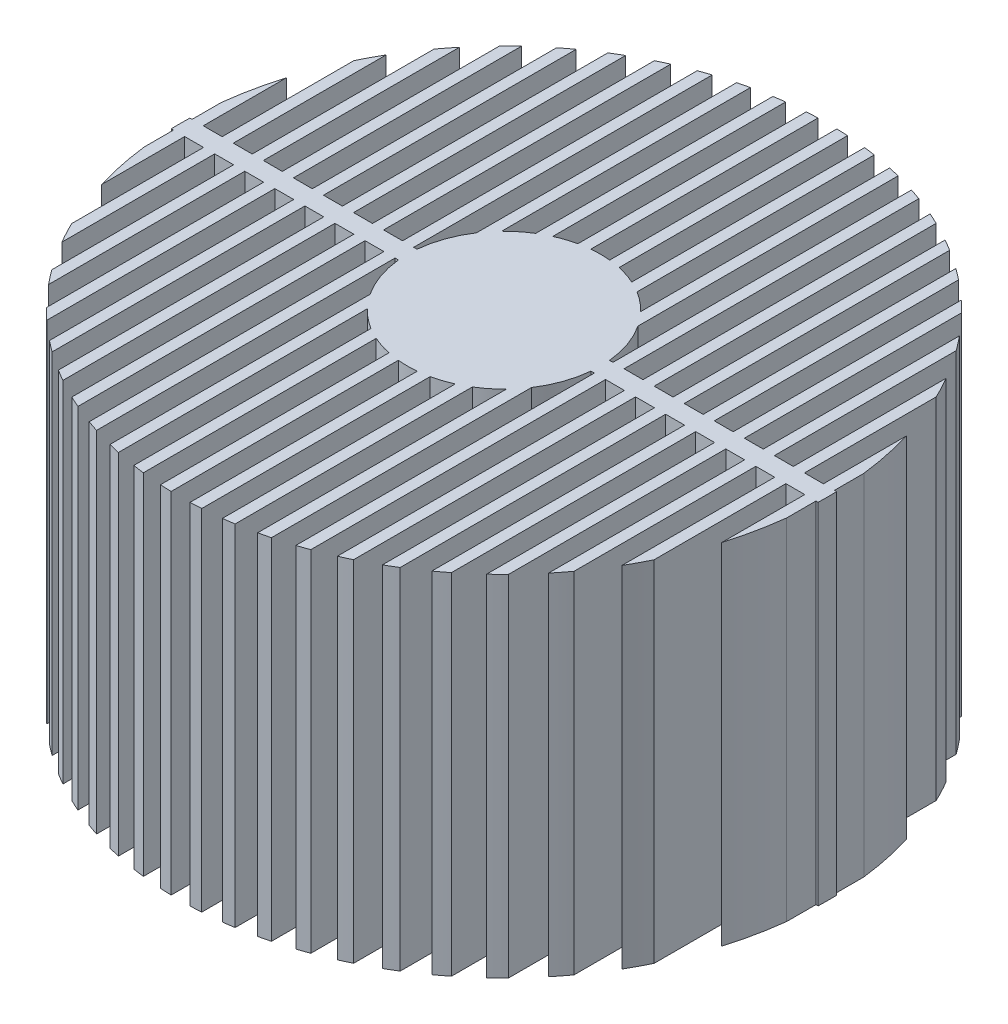
from build123d import *

# Parameters (mm, degrees)
SALIENTE_EXTRUIR3_DEPTH = 47
CROQUIS4_W              = 1.5
CROQUIS4_H              = 87
SALIENTE_EXTRUIR4_DEPTH = 47
CROQUIS5_OUTSIDE_W      = 115.342
CROQUIS5_OUTSIDE_H      = 115.342
CROQUIS5_OUTSIDE_R      = 43.5
CORTAR_EXTRUIR1_DEPTH   = 47


with BuildPart() as part:
    # Croquis3 → Saliente-Extruir3 (new body)
    with BuildSketch(Plane(origin=(0, 0, 0), x_dir=(1, 0, 0), z_dir=(0, 1, 0))):
        with BuildLine():
            Line((-43.5, 1.25), (-12.939764295, 1.25))
            ThreePointArc((-12.939764295, 1.25), (0, 13), (12.939764295, 1.25))
            Line((12.939764295, 1.25), (43.5, 1.25))
            Line((43.5, 1.25), (43.5, -1.25))
            Line((43.5, -1.25), (12.939764295, -1.25))
            ThreePointArc((12.939764295, -1.25), (0, -13), (-12.939764295, -1.25))
            Line((-12.939764295, -1.25), (-43.5, -1.25))
            Line((-43.5, -1.25), (-43.5, 1.25))
        make_face()
    extrude(amount=SALIENTE_EXTRUIR3_DEPTH)

    # Croquis4 → Saliente-Extruir4 (add)
    with BuildSketch(Plane(origin=(0, 47, 0), x_dir=(1, 0, 0), z_dir=(0, 1, 0))):
        with Locations((-42.437546, 0)):
            Rectangle(CROQUIS4_W, CROQUIS4_H)
        with Locations((-38.395758095, 0)):
            Rectangle(CROQUIS4_W, CROQUIS4_H)
        with Locations((-34.35397019, 0)):
            Rectangle(CROQUIS4_W, CROQUIS4_H)
        with Locations((-30.312182286, 0)):
            Rectangle(CROQUIS4_W, CROQUIS4_H)
        with Locations((-26.270394381, 0)):
            Rectangle(CROQUIS4_W, CROQUIS4_H)
        with Locations((-22.228606476, 0)):
            Rectangle(CROQUIS4_W, CROQUIS4_H)
        with Locations((-18.186818571, 0)):
            Rectangle(CROQUIS4_W, CROQUIS4_H)
        with Locations((-14.145030667, 0)):
            Rectangle(CROQUIS4_W, CROQUIS4_H)
        with Locations((-10.103242762, 0)):
            Rectangle(CROQUIS4_W, CROQUIS4_H)
        with Locations((-6.061454857, 0)):
            Rectangle(CROQUIS4_W, CROQUIS4_H)
        with Locations((-2.019666952, 0)):
            Rectangle(CROQUIS4_W, CROQUIS4_H)
        with Locations((2.022120952, 0)):
            Rectangle(CROQUIS4_W, CROQUIS4_H)
        with Locations((6.063908857, 0)):
            Rectangle(CROQUIS4_W, CROQUIS4_H)
        with Locations((10.105696762, 0)):
            Rectangle(CROQUIS4_W, CROQUIS4_H)
        with Locations((14.147484667, 0)):
            Rectangle(CROQUIS4_W, CROQUIS4_H)
        with Locations((18.189272571, 0)):
            Rectangle(CROQUIS4_W, CROQUIS4_H)
        with Locations((22.231060476, 0)):
            Rectangle(CROQUIS4_W, CROQUIS4_H)
        with Locations((26.272848381, 0)):
            Rectangle(CROQUIS4_W, CROQUIS4_H)
        with Locations((30.314636286, 0)):
            Rectangle(CROQUIS4_W, CROQUIS4_H)
        with Locations((34.35642419, 0)):
            Rectangle(CROQUIS4_W, CROQUIS4_H)
        with Locations((38.398212095, 0)):
            Rectangle(CROQUIS4_W, CROQUIS4_H)
        with Locations((42.44, 0)):
            Rectangle(CROQUIS4_W, CROQUIS4_H)
    extrude(amount=-SALIENTE_EXTRUIR4_DEPTH)

    # Croquis5 outside → Cortar-Extruir1 (cut)
    with BuildSketch(Plane(origin=(0, 47, 0), x_dir=(1, 0, 0), z_dir=(0, 1, 0))):
        Rectangle(CROQUIS5_OUTSIDE_W, CROQUIS5_OUTSIDE_H)
        Circle(CROQUIS5_OUTSIDE_R, mode=Mode.SUBTRACT)
    extrude(amount=-CORTAR_EXTRUIR1_DEPTH, mode=Mode.SUBTRACT)


solid = part.part
